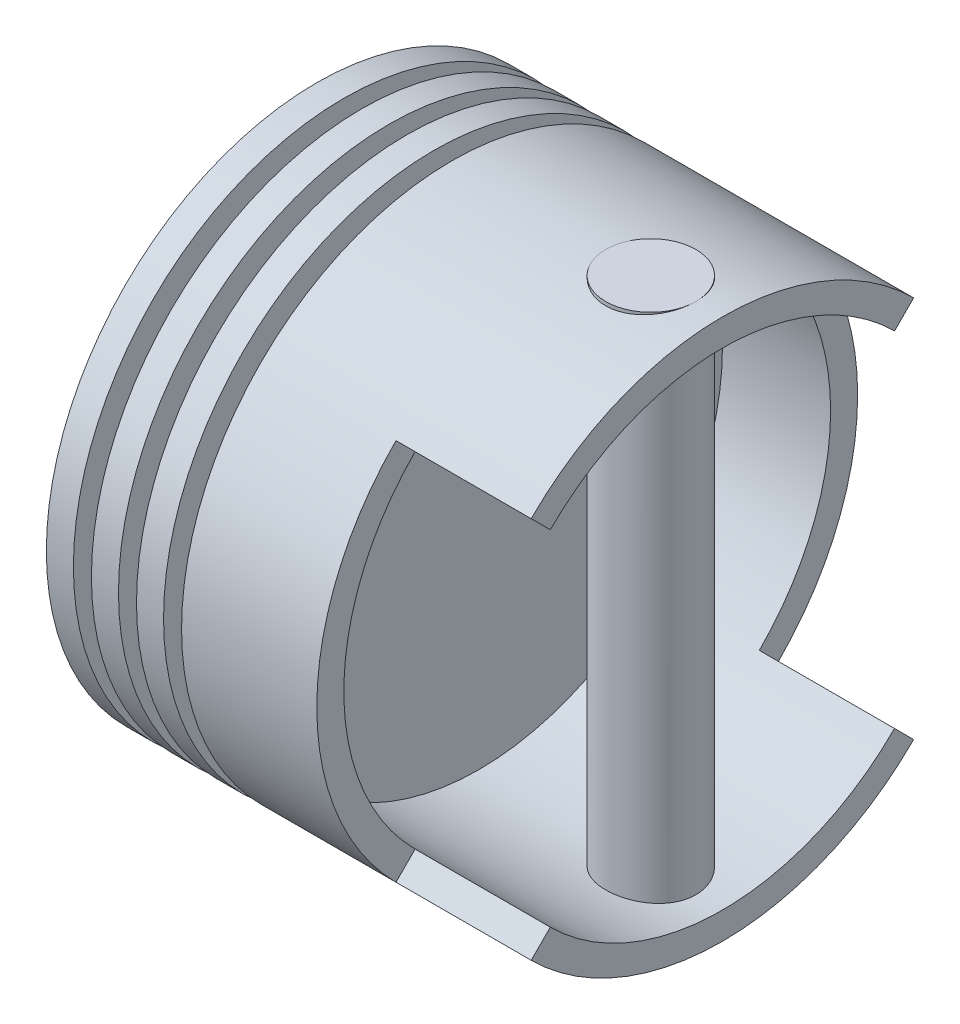
from build123d import *

# Parameters (mm, degrees)
SKETCH1_R            = 30
BOSS_EXTRUDE1_DEPTH  = 3
SKETCH2_W            = 7
SKETCH2_H            = 50
BOSS_EXTRUDE2_DEPTH  = 2
SKETCH3_R            = 30
BOSS_EXTRUDE3_DEPTH  = 3
SKETCH4_W            = 7
SKETCH4_H            = 50
BOSS_EXTRUDE4_DEPTH  = 2
SKETCH5_R            = 30
BOSS_EXTRUDE5_DEPTH  = 3
SKETCH6_W            = 7
SKETCH6_H            = 50
BOSS_EXTRUDE6_DEPTH  = 2
SKETCH7_R            = 30
BOSS_EXTRUDE7_DEPTH  = 30
SKETCH8_R            = 27
CUT_EXTRUDE3_DEPTH   = 27
CUT_EXTRUDE6_START   = -15
CUT_EXTRUDE6_DEPTH   = 15
BOSS_EXTRUDE11_START = -30.000001
SKETCH14_R           = 5
BOSS_EXTRUDE11_DEPTH = 60.000002


with BuildPart() as part:
    # Sketch1 → Boss-Extrude1 (new body)
    with BuildSketch(Plane(origin=(0, 0, 0), x_dir=(0, 0, -1), z_dir=(1, 0, 0))):
        Circle(SKETCH1_R)
    extrude(amount=BOSS_EXTRUDE1_DEPTH)

    # Sketch2 → Boss-Extrude2 (add)
    with BuildSketch(Plane(origin=(3, 0, 0), x_dir=(0, 0, -1), z_dir=(1, 0, 0))):
        Rectangle(SKETCH2_W, SKETCH2_H)
    extrude(amount=BOSS_EXTRUDE2_DEPTH)

    # Sketch3 → Boss-Extrude3 (add)
    with BuildSketch(Plane(origin=(5, 0, 0), x_dir=(0, 0, -1), z_dir=(1, 0, 0))):
        Circle(SKETCH3_R)
    extrude(amount=BOSS_EXTRUDE3_DEPTH)

    # Sketch4 → Boss-Extrude4 (add)
    with BuildSketch(Plane(origin=(8, 0, 0), x_dir=(0, 0, -1), z_dir=(1, 0, 0))):
        Rectangle(SKETCH4_W, SKETCH4_H)
    extrude(amount=BOSS_EXTRUDE4_DEPTH)

    # Sketch5 → Boss-Extrude5 (add)
    with BuildSketch(Plane(origin=(10, 0, 0), x_dir=(0, 0, -1), z_dir=(1, 0, 0))):
        Circle(SKETCH5_R)
    extrude(amount=BOSS_EXTRUDE5_DEPTH)

    # Sketch6 → Boss-Extrude6 (add)
    with BuildSketch(Plane(origin=(13, 0, 0), x_dir=(0, 0, -1), z_dir=(1, 0, 0))):
        Rectangle(SKETCH6_W, SKETCH6_H)
    extrude(amount=BOSS_EXTRUDE6_DEPTH)

    # Sketch7 → Boss-Extrude7 (add)
    with BuildSketch(Plane(origin=(15, 0, 0), x_dir=(0, 0, -1), z_dir=(1, 0, 0))):
        Circle(SKETCH7_R)
    extrude(amount=BOSS_EXTRUDE7_DEPTH)

    # Sketch8 → Cut-Extrude3 (cut)
    with BuildSketch(Plane(origin=(45, 0, 0), x_dir=(0, 0, -1), z_dir=(1, 0, 0))):
        Circle(SKETCH8_R)
    extrude(amount=-CUT_EXTRUDE3_DEPTH, mode=Mode.SUBTRACT)

    # Sketch9 → Cut-Extrude6 (cut)
    with BuildSketch(Plane(origin=(45, 0, 0), x_dir=(0, 0, -1), z_dir=(1, 0, 0)).offset(CUT_EXTRUDE6_START)):
        with BuildLine():
            Line((21.213203436, 21.213203436), (19.091883092, 19.091883092))
            ThreePointArc((19.091883092, 19.091883092), (27, 0), (19.091883092, -19.091883092))
            Line((19.091883092, -19.091883092), (21.213203436, -21.213203436))
            ThreePointArc((21.213203436, -21.213203436), (30, 0), (21.213203436, 21.213203436))
        make_face()
        with BuildLine():
            Line((-21.213203436, 21.213203436), (-19.091883092, 19.091883092))
            ThreePointArc((-19.091883092, 19.091883092), (-27, 0), (-19.091883092, -19.091883092))
            Line((-19.091883092, -19.091883092), (-21.213203436, -21.213203436))
            ThreePointArc((-21.213203436, -21.213203436), (-30, 0), (-21.213203436, 21.213203436))
        make_face()
    extrude(amount=CUT_EXTRUDE6_DEPTH, mode=Mode.SUBTRACT)

    # Sketch14 → Boss-Extrude11 (add)
    with BuildSketch(Plane(origin=(0, 0, 0), x_dir=(1, 0, 0), z_dir=(0, 1, 0)).offset(BOSS_EXTRUDE11_START)):
        with Locations(Location((37.056780036, 0, 0), (0, 0, 90))):
            Circle(SKETCH14_R)
    extrude(amount=BOSS_EXTRUDE11_DEPTH)


solid = part.part
